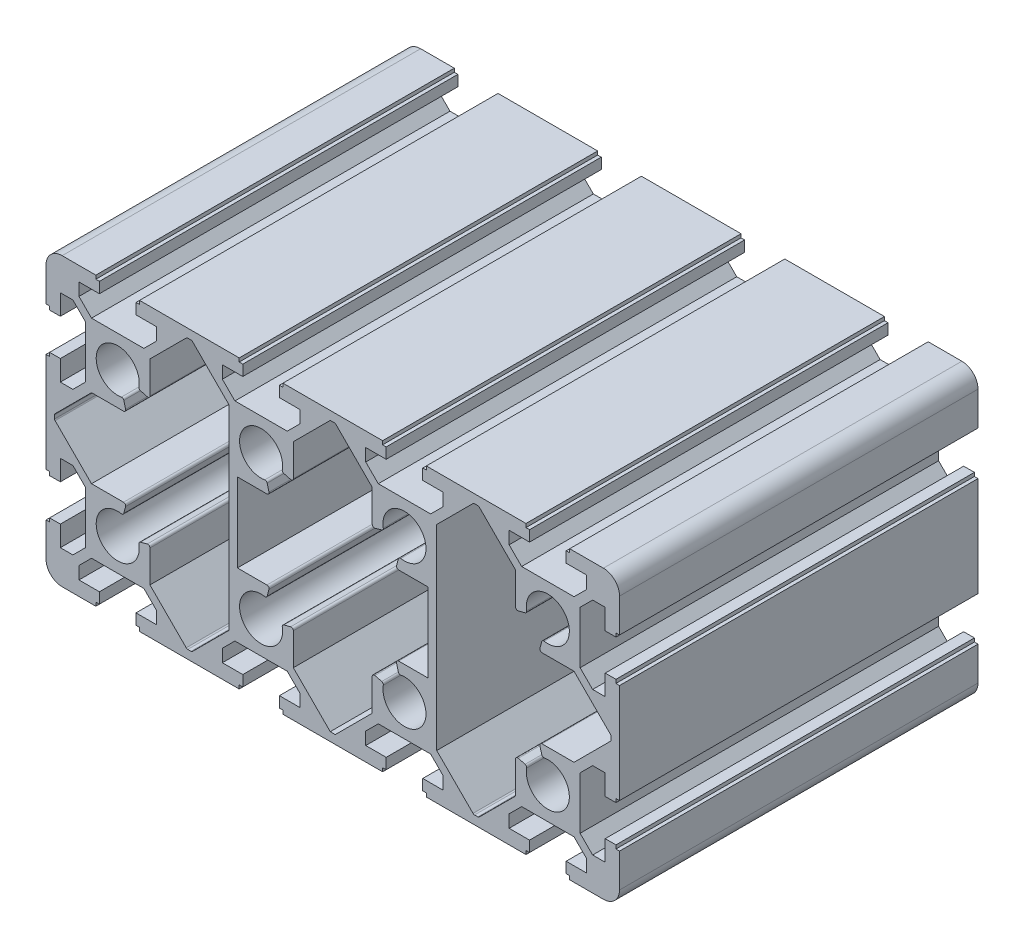
from build123d import *

# Parameters (mm, degrees)
EXTRUDE_1_DEPTH = 100


with BuildPart() as part:
    # 草图1 → 凸台-拉伸1 (new body)
    with BuildSketch(Plane.XY):
        with BuildLine():
            Line((76.728412146, -8.442987377), (73.225468421, -8.442987377))
            Line((73.225468421, -8.442987377), (69.728412146, -11.940043652))
            Line((69.728412146, -11.940043652), (69.728412146, -26.545931102))
            Line((69.728412146, -26.545931102), (73.225468421, -30.042987377))
            Line((73.225468421, -30.042987377), (76.728412146, -30.042987377))
            Line((76.728412146, -30.042987377), (76.728412146, -24.342987377))
            Line((76.728412146, -24.342987377), (79.728412146, -24.342987377))
            Line((79.728412146, -24.342987377), (79.728412146, -25.342987377))
            Line((79.728412146, -25.342987377), (80.728412146, -25.342987377))
            Line((80.728412146, -25.342987377), (80.728412146, -34.742987377))
            ThreePointArc((80.728412146, -34.742987377), (79.410392661, -37.924967893), (76.228412146, -39.242987377))
            Line((76.228412146, -39.242987377), (66.828412146, -39.242987377))
            Line((66.828412146, -39.242987377), (66.828412146, -38.242987377))
            Line((66.828412146, -38.242987377), (65.828412146, -38.242987377))
            Line((65.828412146, -38.242987377), (65.828412146, -35.242987377))
            Line((65.828412146, -35.242987377), (71.528412146, -35.242987377))
            Line((71.528412146, -35.242987377), (71.528412146, -31.740043652))
            Line((71.528412146, -31.740043652), (68.031355871, -28.242987377))
            Line((68.031355871, -28.242987377), (53.425468421, -28.242987377))
            Line((53.425468421, -28.242987377), (49.928412146, -31.740043652))
            Line((49.928412146, -31.740043652), (49.928412146, -35.242987377))
            Line((49.928412146, -35.242987377), (55.628412146, -35.242987377))
            Line((55.628412146, -35.242987377), (55.628412146, -38.242987377))
            Line((55.628412146, -38.242987377), (54.628412146, -38.242987377))
            Line((54.628412146, -38.242987377), (54.628412146, -39.242987377))
            Line((54.628412146, -39.242987377), (26.828412146, -39.242987377))
            Line((26.828412146, -39.242987377), (26.828412146, -38.242987377))
            Line((26.828412146, -38.242987377), (25.828412146, -38.242987377))
            Line((25.828412146, -38.242987377), (25.828412146, -35.242987377))
            Line((25.828412146, -35.242987377), (31.528412146, -35.242987377))
            Line((31.528412146, -35.242987377), (31.528412146, -31.740043652))
            Line((31.528412146, -31.740043652), (28.031355871, -28.242987377))
            Line((28.031355871, -28.242987377), (13.425468421, -28.242987377))
            Line((13.425468421, -28.242987377), (9.928412146, -31.740043652))
            Line((9.928412146, -31.740043652), (9.928412146, -35.242987377))
            Line((9.928412146, -35.242987377), (15.628412146, -35.242987377))
            Line((15.628412146, -35.242987377), (15.628412146, -38.242987377))
            Line((15.628412146, -38.242987377), (14.628412146, -38.242987377))
            Line((14.628412146, -38.242987377), (14.628412146, -39.242987377))
            Line((14.628412146, -39.242987377), (-13.171587854, -39.242987377))
            Line((-13.171587854, -39.242987377), (-13.171587854, -38.242987377))
            Line((-13.171587854, -38.242987377), (-14.171587854, -38.242987377))
            Line((-14.171587854, -38.242987377), (-14.171587854, -35.242987377))
            Line((-14.171587854, -35.242987377), (-8.471587854, -35.242987377))
            Line((-8.471587854, -35.242987377), (-8.471587854, -31.740043652))
            Line((-8.471587854, -31.740043652), (-11.968644129, -28.242987377))
            Line((-11.968644129, -28.242987377), (-26.574531579, -28.242987377))
            Line((-26.574531579, -28.242987377), (-30.071587854, -31.740043652))
            Line((-30.071587854, -31.740043652), (-30.071587854, -35.242987377))
            Line((-30.071587854, -35.242987377), (-24.371587854, -35.242987377))
            Line((-24.371587854, -35.242987377), (-24.371587854, -38.242987377))
            Line((-24.371587854, -38.242987377), (-25.371587854, -38.242987377))
            Line((-25.371587854, -38.242987377), (-25.371587854, -39.242987377))
            Line((-25.371587854, -39.242987377), (-53.171587854, -39.242987377))
            Line((-53.171587854, -39.242987377), (-53.171587854, -38.242987377))
            Line((-53.171587854, -38.242987377), (-54.171587854, -38.242987377))
            Line((-54.171587854, -38.242987377), (-54.171587854, -35.242987377))
            Line((-54.171587854, -35.242987377), (-48.471587854, -35.242987377))
            Line((-48.471587854, -35.242987377), (-48.471587854, -31.740043652))
            Line((-48.471587854, -31.740043652), (-51.968644129, -28.242987377))
            Line((-51.968644129, -28.242987377), (-66.574531579, -28.242987377))
            Line((-66.574531579, -28.242987377), (-70.071587854, -31.740043652))
            Line((-70.071587854, -31.740043652), (-70.071587854, -35.242987377))
            Line((-70.071587854, -35.242987377), (-64.371587854, -35.242987377))
            Line((-64.371587854, -35.242987377), (-64.371587854, -38.242987377))
            Line((-64.371587854, -38.242987377), (-65.371587854, -38.242987377))
            Line((-65.371587854, -38.242987377), (-65.371587854, -39.242987377))
            Line((-65.371587854, -39.242987377), (-74.771587854, -39.242987377))
            ThreePointArc((-74.771587854, -39.242987377), (-77.95356837, -37.924967893), (-79.271587854, -34.742987377))
            Line((-79.271587854, -34.742987377), (-79.271587854, -25.342987377))
            Line((-79.271587854, -25.342987377), (-78.271587854, -25.342987377))
            Line((-78.271587854, -25.342987377), (-78.271587854, -24.342987377))
            Line((-78.271587854, -24.342987377), (-75.271587854, -24.342987377))
            Line((-75.271587854, -24.342987377), (-75.271587854, -30.042987377))
            Line((-75.271587854, -30.042987377), (-71.768644129, -30.042987377))
            Line((-71.768644129, -30.042987377), (-68.271587854, -26.545931102))
            Line((-68.271587854, -26.545931102), (-68.271587854, -11.940043652))
            Line((-68.271587854, -11.940043652), (-71.768644129, -8.442987377))
            Line((-71.768644129, -8.442987377), (-75.271587854, -8.442987377))
            Line((-75.271587854, -8.442987377), (-75.271587854, -14.142987377))
            Line((-75.271587854, -14.142987377), (-78.271587854, -14.142987377))
            Line((-78.271587854, -14.142987377), (-78.271587854, -13.142987377))
            Line((-78.271587854, -13.142987377), (-79.271587854, -13.142987377))
            Line((-79.271587854, -13.142987377), (-79.271587854, 14.657012623))
            Line((-79.271587854, 14.657012623), (-78.271587854, 14.657012623))
            Line((-78.271587854, 14.657012623), (-78.271587854, 15.657012623))
            Line((-78.271587854, 15.657012623), (-75.271587854, 15.657012623))
            Line((-75.271587854, 15.657012623), (-75.271587854, 9.957012623))
            Line((-75.271587854, 9.957012623), (-71.768644129, 9.957012623))
            Line((-71.768644129, 9.957012623), (-68.271587854, 13.454068898))
            Line((-68.271587854, 13.454068898), (-68.271587854, 28.059956348))
            Line((-68.271587854, 28.059956348), (-71.768644129, 31.557012623))
            Line((-71.768644129, 31.557012623), (-75.271587854, 31.557012623))
            Line((-75.271587854, 31.557012623), (-75.271587854, 25.857012623))
            Line((-75.271587854, 25.857012623), (-78.271587854, 25.857012623))
            Line((-78.271587854, 25.857012623), (-78.271587854, 26.857012623))
            Line((-78.271587854, 26.857012623), (-79.271587854, 26.857012623))
            Line((-79.271587854, 26.857012623), (-79.271587854, 36.257012623))
            ThreePointArc((-79.271587854, 36.257012623), (-77.95356837, 39.438993138), (-74.771587854, 40.757012623))
            Line((-74.771587854, 40.757012623), (-65.371587854, 40.757012623))
            Line((-65.371587854, 40.757012623), (-65.371587854, 39.757012623))
            Line((-65.371587854, 39.757012623), (-64.371587854, 39.757012623))
            Line((-64.371587854, 39.757012623), (-64.371587854, 36.757012623))
            Line((-64.371587854, 36.757012623), (-70.071587854, 36.757012623))
            Line((-70.071587854, 36.757012623), (-70.071587854, 33.254068898))
            Line((-70.071587854, 33.254068898), (-66.574531579, 29.757012623))
            Line((-66.574531579, 29.757012623), (-51.968644129, 29.757012623))
            Line((-51.968644129, 29.757012623), (-48.471587854, 33.254068898))
            Line((-48.471587854, 33.254068898), (-48.471587854, 36.757012623))
            Line((-48.471587854, 36.757012623), (-54.171587854, 36.757012623))
            Line((-54.171587854, 36.757012623), (-54.171587854, 39.757012623))
            Line((-54.171587854, 39.757012623), (-53.171587854, 39.757012623))
            Line((-53.171587854, 39.757012623), (-53.171587854, 40.757012623))
            Line((-53.171587854, 40.757012623), (-25.371587854, 40.757012623))
            Line((-25.371587854, 40.757012623), (-25.371587854, 39.757012623))
            Line((-25.371587854, 39.757012623), (-24.371587854, 39.757012623))
            Line((-24.371587854, 39.757012623), (-24.371587854, 36.757012623))
            Line((-24.371587854, 36.757012623), (-30.071587854, 36.757012623))
            Line((-30.071587854, 36.757012623), (-30.071587854, 33.254068898))
            Line((-30.071587854, 33.254068898), (-26.574531579, 29.757012623))
            Line((-26.574531579, 29.757012623), (-11.968644129, 29.757012623))
            Line((-11.968644129, 29.757012623), (-8.471587854, 33.254068898))
            Line((-8.471587854, 33.254068898), (-8.471587854, 36.757012623))
            Line((-8.471587854, 36.757012623), (-14.171587854, 36.757012623))
            Line((-14.171587854, 36.757012623), (-14.171587854, 39.757012623))
            Line((-14.171587854, 39.757012623), (-13.171587854, 39.757012623))
            Line((-13.171587854, 39.757012623), (-13.171587854, 40.757012623))
            Line((-13.171587854, 40.757012623), (14.628412146, 40.757012623))
            Line((14.628412146, 40.757012623), (14.628412146, 39.757012623))
            Line((14.628412146, 39.757012623), (15.628412146, 39.757012623))
            Line((15.628412146, 39.757012623), (15.628412146, 36.757012623))
            Line((15.628412146, 36.757012623), (9.928412146, 36.757012623))
            Line((9.928412146, 36.757012623), (9.928412146, 33.254068898))
            Line((9.928412146, 33.254068898), (13.425468421, 29.757012623))
            Line((13.425468421, 29.757012623), (28.031355871, 29.757012623))
            Line((28.031355871, 29.757012623), (31.528412146, 33.254068898))
            Line((31.528412146, 33.254068898), (31.528412146, 36.757012623))
            Line((31.528412146, 36.757012623), (25.828412146, 36.757012623))
            Line((25.828412146, 36.757012623), (25.828412146, 39.757012623))
            Line((25.828412146, 39.757012623), (26.828412146, 39.757012623))
            Line((26.828412146, 39.757012623), (26.828412146, 40.757012623))
            Line((26.828412146, 40.757012623), (54.628412146, 40.757012623))
            Line((54.628412146, 40.757012623), (54.628412146, 39.757012623))
            Line((54.628412146, 39.757012623), (55.628412146, 39.757012623))
            Line((55.628412146, 39.757012623), (55.628412146, 36.757012623))
            Line((55.628412146, 36.757012623), (49.928412146, 36.757012623))
            Line((49.928412146, 36.757012623), (49.928412146, 33.254068898))
            Line((49.928412146, 33.254068898), (53.425468421, 29.757012623))
            Line((53.425468421, 29.757012623), (68.031355871, 29.757012623))
            Line((68.031355871, 29.757012623), (71.528412146, 33.254068898))
            Line((71.528412146, 33.254068898), (71.528412146, 36.757012623))
            Line((71.528412146, 36.757012623), (65.828412146, 36.757012623))
            Line((65.828412146, 36.757012623), (65.828412146, 39.757012623))
            Line((65.828412146, 39.757012623), (66.828412146, 39.757012623))
            Line((66.828412146, 39.757012623), (66.828412146, 40.757012623))
            Line((66.828412146, 40.757012623), (76.228412146, 40.757012623))
            ThreePointArc((76.228412146, 40.757012623), (79.410392661, 39.438993138), (80.728412146, 36.257012623))
            Line((80.728412146, 36.257012623), (80.728412146, 26.857012623))
            Line((80.728412146, 26.857012623), (79.728412146, 26.857012623))
            Line((79.728412146, 26.857012623), (79.728412146, 25.857012623))
            Line((79.728412146, 25.857012623), (76.728412146, 25.857012623))
            Line((76.728412146, 25.857012623), (76.728412146, 31.557012623))
            Line((76.728412146, 31.557012623), (73.225468421, 31.557012623))
            Line((73.225468421, 31.557012623), (69.728412146, 28.059956348))
            Line((69.728412146, 28.059956348), (69.728412146, 13.454068898))
            Line((69.728412146, 13.454068898), (73.225468421, 9.957012623))
            Line((73.225468421, 9.957012623), (76.728412146, 9.957012623))
            Line((76.728412146, 9.957012623), (76.728412146, 15.657012623))
            Line((76.728412146, 15.657012623), (79.728412146, 15.657012623))
            Line((79.728412146, 15.657012623), (79.728412146, 14.657012623))
            Line((79.728412146, 14.657012623), (80.728412146, 14.657012623))
            Line((80.728412146, 14.657012623), (80.728412146, -13.142987377))
            Line((80.728412146, -13.142987377), (79.728412146, -13.142987377))
            Line((79.728412146, -13.142987377), (79.728412146, -14.142987377))
            Line((79.728412146, -14.142987377), (76.728412146, -14.142987377))
            Line((76.728412146, -14.142987377), (76.728412146, -8.442987377))
        make_face()
        with BuildLine():
            Line((-76.871587854, 0.261175679), (-76.871587854, 1.252849567))
            ThreePointArc((-76.871587854, 1.252849567), (-76.83352762, 1.444191283), (-76.725141245, 1.606402957))
            Line((-76.725141245, 1.606402957), (-66.574531579, 11.757012623))
            Line((-66.574531579, 11.757012623), (-57.641980346, 11.757012623))
            ThreePointArc((-57.641980346, 11.757012623), (-57.165968342, 11.991755765), (-57.06242485, 12.51230405))
            Line((-57.06242485, 12.51230405), (-57.570455502, 14.408300255))
            ThreePointArc((-57.570455502, 14.408300255), (-57.826678356, 14.758435384), (-58.251972531, 14.844281901))
            ThreePointArc((-58.251972531, 14.844281901), (-63.514228541, 24.99965331), (-53.358857132, 19.737397299))
            ThreePointArc((-53.358857132, 19.737397299), (-53.273010615, 19.312103125), (-52.922875487, 19.055880271))
            Line((-52.922875487, 19.055880271), (-51.026879281, 18.547849619))
            ThreePointArc((-51.026879281, 18.547849619), (-50.506330997, 18.65139311), (-50.271587854, 19.127405115))
            Line((-50.271587854, 19.127405115), (-50.271587854, 28.059956348))
            Line((-50.271587854, 28.059956348), (-40.150267511, 38.181276691))
            ThreePointArc((-40.150267511, 38.181276691), (-39.955613501, 38.311340342), (-39.726003442, 38.357012623))
            Line((-39.726003442, 38.357012623), (-38.817172266, 38.357012623))
            ThreePointArc((-38.817172266, 38.357012623), (-38.587562207, 38.311340342), (-38.392908198, 38.181276691))
            Line((-38.392908198, 38.181276691), (-28.271587854, 28.059956348))
            Line((-28.271587854, 28.059956348), (-28.271587854, -26.545931102))
            Line((-28.271587854, -26.545931102), (-38.392908198, -36.667251446))
            ThreePointArc((-38.392908198, -36.667251446), (-38.587562207, -36.797315097), (-38.817172266, -36.842987377))
            Line((-38.817172266, -36.842987377), (-39.726003442, -36.842987377))
            ThreePointArc((-39.726003442, -36.842987377), (-39.955613501, -36.797315097), (-40.150267511, -36.667251446))
            Line((-40.150267511, -36.667251446), (-50.271587854, -26.545931102))
            Line((-50.271587854, -26.545931102), (-50.271587854, -17.613379869))
            ThreePointArc((-50.271587854, -17.613379869), (-50.506330997, -17.137367865), (-51.026879281, -17.033824373))
            Line((-51.026879281, -17.033824373), (-52.922875487, -17.541855025))
            ThreePointArc((-52.922875487, -17.541855025), (-53.273010615, -17.79807788), (-53.358857132, -18.223372054))
            ThreePointArc((-53.358857132, -18.223372054), (-63.514228541, -23.485628064), (-58.251972531, -13.330256655))
            ThreePointArc((-58.251972531, -13.330256655), (-57.826678356, -13.244410138), (-57.570455502, -12.89427501))
            Line((-57.570455502, -12.89427501), (-57.06242485, -10.998278804))
            ThreePointArc((-57.06242485, -10.998278804), (-57.165968342, -10.47773052), (-57.641980346, -10.242987377))
            Line((-57.641980346, -10.242987377), (-66.574531579, -10.242987377))
            Line((-66.574531579, -10.242987377), (-76.725141245, -0.092377712))
            ThreePointArc((-76.725141245, -0.092377712), (-76.83352762, 0.069833963), (-76.871587854, 0.261175679))
        make_face(mode=Mode.SUBTRACT)
        with BuildLine():
            Line((-10.271587854, -26.545931102), (-10.271587854, -17.613379869))
            ThreePointArc((-10.271587854, -17.613379869), (-10.506330997, -17.137367865), (-11.026879281, -17.033824373))
            Line((-11.026879281, -17.033824373), (-12.922875487, -17.541855026))
            ThreePointArc((-12.922875487, -17.541855026), (-13.273010615, -17.79807788), (-13.358857132, -18.223372054))
            ThreePointArc((-13.358857132, -18.223372054), (-23.514228541, -23.485628064), (-18.251972531, -13.330256655))
            ThreePointArc((-18.251972531, -13.330256655), (-17.826678356, -13.244410138), (-17.570455502, -12.89427501))
            Line((-17.570455502, -12.89427501), (-17.06242485, -10.998278804))
            ThreePointArc((-17.06242485, -10.998278804), (-17.165968342, -10.47773052), (-17.641980346, -10.242987377))
            Line((-17.641980346, -10.242987377), (-25.871587854, -10.242987377))
            Line((-25.871587854, -10.242987377), (-25.871587854, 11.757012623))
            Line((-25.871587854, 11.757012623), (-17.641980346, 11.757012623))
            ThreePointArc((-17.641980346, 11.757012623), (-17.165968342, 11.991755765), (-17.06242485, 12.51230405))
            Line((-17.06242485, 12.51230405), (-17.570455502, 14.408300255))
            ThreePointArc((-17.570455502, 14.408300255), (-17.826678356, 14.758435384), (-18.251972531, 14.844281901))
            ThreePointArc((-18.251972531, 14.844281901), (-23.514228541, 24.99965331), (-13.358857132, 19.737397299))
            ThreePointArc((-13.358857132, 19.737397299), (-13.273010615, 19.312103125), (-12.922875487, 19.055880271))
            Line((-12.922875487, 19.055880271), (-11.026879281, 18.547849619))
            ThreePointArc((-11.026879281, 18.547849619), (-10.506330997, 18.65139311), (-10.271587854, 19.127405115))
            Line((-10.271587854, 19.127405115), (-10.271587854, 28.059956348))
            Line((-10.271587854, 28.059956348), (0.025468421, 38.357012623))
            Line((0.025468421, 38.357012623), (1.431355871, 38.357012623))
            Line((1.431355871, 38.357012623), (11.728412146, 28.059956348))
            Line((11.728412146, 28.059956348), (11.728412146, 19.127405115))
            ThreePointArc((11.728412146, 19.127405115), (11.963155288, 18.65139311), (12.483703573, 18.547849619))
            Line((12.483703573, 18.547849619), (14.379699779, 19.055880271))
            ThreePointArc((14.379699779, 19.055880271), (14.729834907, 19.312103125), (14.815681424, 19.737397299))
            ThreePointArc((14.815681424, 19.737397299), (24.971052833, 24.99965331), (19.708796822, 14.844281901))
            ThreePointArc((19.708796822, 14.844281901), (19.283502648, 14.758435384), (19.027279794, 14.408300255))
            Line((19.027279794, 14.408300255), (18.519249142, 12.51230405))
            ThreePointArc((18.519249142, 12.51230405), (18.622792633, 11.991755765), (19.098804638, 11.757012623))
            Line((19.098804638, 11.757012623), (27.328412146, 11.757012623))
            Line((27.328412146, 11.757012623), (27.328412146, -10.242987377))
            Line((27.328412146, -10.242987377), (19.098804638, -10.242987377))
            ThreePointArc((19.098804638, -10.242987377), (18.622792633, -10.47773052), (18.519249142, -10.998278804))
            Line((18.519249142, -10.998278804), (19.027279794, -12.89427501))
            ThreePointArc((19.027279794, -12.89427501), (19.283502648, -13.244410138), (19.708796822, -13.330256655))
            ThreePointArc((19.708796822, -13.330256655), (24.971052833, -23.485628064), (14.815681424, -18.223372054))
            ThreePointArc((14.815681424, -18.223372054), (14.729834907, -17.79807788), (14.379699779, -17.541855026))
            Line((14.379699779, -17.541855026), (12.483703573, -17.033824373))
            ThreePointArc((12.483703573, -17.033824373), (11.963155288, -17.137367865), (11.728412146, -17.613379869))
            Line((11.728412146, -17.613379869), (11.728412146, -26.545931102))
            Line((11.728412146, -26.545931102), (1.431355871, -36.842987377))
            Line((1.431355871, -36.842987377), (0.025468421, -36.842987377))
            Line((0.025468421, -36.842987377), (-10.271587854, -26.545931102))
        make_face(mode=Mode.SUBTRACT)
        with BuildLine():
            Line((58.519249142, 12.51230405), (59.027279794, 14.408300255))
            ThreePointArc((59.027279794, 14.408300255), (59.283502648, 14.758435384), (59.708796822, 14.844281901))
            ThreePointArc((59.708796822, 14.844281901), (64.971052833, 24.99965331), (54.815681424, 19.737397299))
            ThreePointArc((54.815681424, 19.737397299), (54.729834907, 19.312103125), (54.379699779, 19.055880271))
            Line((54.379699779, 19.055880271), (52.483703573, 18.547849619))
            ThreePointArc((52.483703573, 18.547849619), (51.963155288, 18.65139311), (51.728412146, 19.127405115))
            Line((51.728412146, 19.127405115), (51.728412146, 28.059956348))
            Line((51.728412146, 28.059956348), (41.607091802, 38.181276691))
            ThreePointArc((41.607091802, 38.181276691), (41.412437793, 38.311340342), (41.182827734, 38.357012623))
            Line((41.182827734, 38.357012623), (40.273996558, 38.357012623))
            ThreePointArc((40.273996558, 38.357012623), (40.044386499, 38.311340342), (39.849732489, 38.181276691))
            Line((39.849732489, 38.181276691), (29.728412146, 28.059956348))
            Line((29.728412146, 28.059956348), (29.728412146, -26.545931102))
            Line((29.728412146, -26.545931102), (39.849732489, -36.667251446))
            ThreePointArc((39.849732489, -36.667251446), (40.044386499, -36.797315097), (40.273996558, -36.842987377))
            Line((40.273996558, -36.842987377), (41.182827734, -36.842987377))
            ThreePointArc((41.182827734, -36.842987377), (41.412437793, -36.797315097), (41.607091802, -36.667251446))
            Line((41.607091802, -36.667251446), (51.728412146, -26.545931102))
            Line((51.728412146, -26.545931102), (51.728412146, -17.613379869))
            ThreePointArc((51.728412146, -17.613379869), (51.963155288, -17.137367865), (52.483703573, -17.033824373))
            Line((52.483703573, -17.033824373), (54.379699779, -17.541855026))
            ThreePointArc((54.379699779, -17.541855026), (54.729834907, -17.79807788), (54.815681424, -18.223372054))
            ThreePointArc((54.815681424, -18.223372054), (64.971052833, -23.485628064), (59.708796822, -13.330256655))
            ThreePointArc((59.708796822, -13.330256655), (59.283502648, -13.244410138), (59.027279794, -12.89427501))
            Line((59.027279794, -12.89427501), (58.519249142, -10.998278804))
            ThreePointArc((58.519249142, -10.998278804), (58.622792633, -10.47773052), (59.098804638, -10.242987377))
            Line((59.098804638, -10.242987377), (68.031355871, -10.242987377))
            Line((68.031355871, -10.242987377), (78.181965536, -0.092377712))
            ThreePointArc((78.181965536, -0.092377712), (78.290351912, 0.069833963), (78.328412146, 0.261175679))
            Line((78.328412146, 0.261175679), (78.328412146, 1.252849567))
            ThreePointArc((78.328412146, 1.252849567), (78.290351912, 1.444191283), (78.181965536, 1.606402957))
            Line((78.181965536, 1.606402957), (68.031355871, 11.757012623))
            Line((68.031355871, 11.757012623), (59.098804638, 11.757012623))
            ThreePointArc((59.098804638, 11.757012623), (58.622792633, 11.991755765), (58.519249142, 12.51230405))
        make_face(mode=Mode.SUBTRACT)
    extrude(amount=EXTRUDE_1_DEPTH)


solid = part.part
